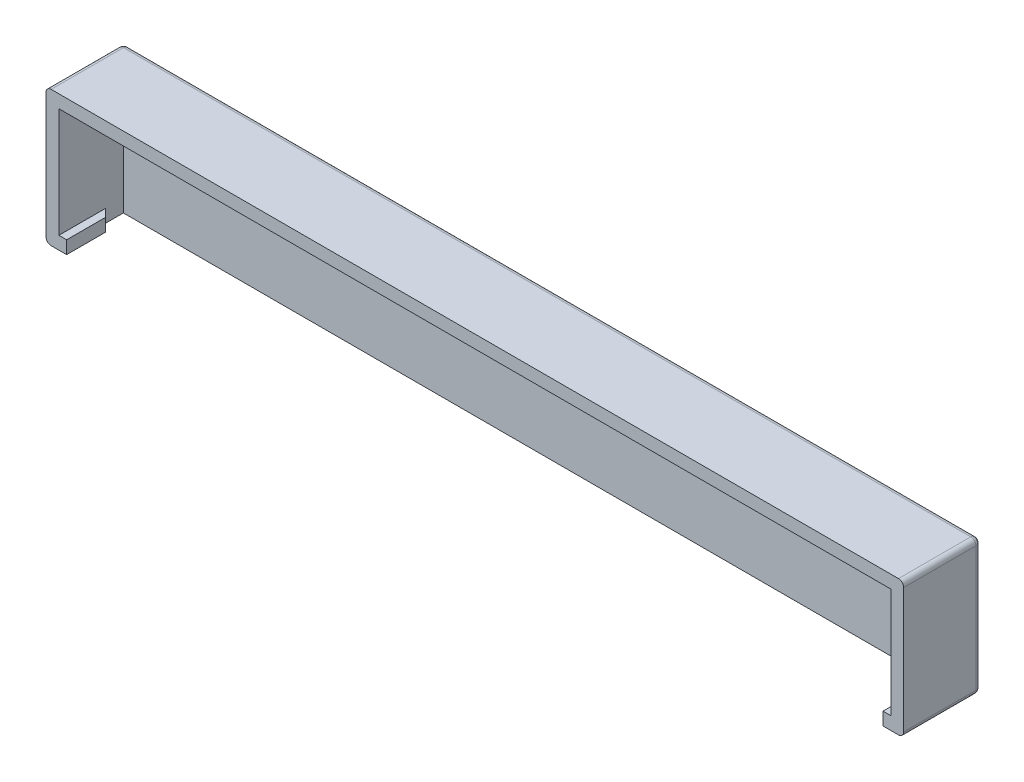
from build123d import *

# Parameters (mm, degrees)
SKETCH1_W           = 211.1375
SKETCH1_H           = 33.3375
BOSS_EXTRUDE1_DEPTH = 3.175
BOSS_EXTRUDE2_DEPTH = 15.875
CUT_EXTRUDE1_REACH  = 216.6
FILLET1_R           = 1.27


with BuildPart() as part:
    # Sketch1 → Boss-Extrude1 (new body)
    with BuildSketch(Plane.XY):
        with Locations((105.56875, 16.66875)):
            Rectangle(SKETCH1_W, SKETCH1_H)
    extrude(amount=BOSS_EXTRUDE1_DEPTH)

    # Sketch2 → Boss-Extrude2 (add)
    with BuildSketch(Plane.XY.offset(3.175)):
        Polygon((5.08, 0), (5.08, 3.175), (3.175, 3.175), (3.175, 30.1625), (207.9625, 30.1625), (207.9625, 3.175), (206.0575, 3.175), (206.0575, 0), (211.1375, 0), (211.1375, 33.3375), (0, 33.3375), (0, 0), align=None)
    extrude(amount=BOSS_EXTRUDE2_DEPTH)

    # Sketch3 → Cut-Extrude1 (cut, up to next)
    with BuildSketch(Plane.XZ, mode=Mode.PRIVATE) as cut_extrude1_sk1:
        Polygon((207.9625, 3.175), (206.0575, 3.175), (206.0575, 9.525), (207.9625, 7.62), align=None)
    cut_extrude1_tool1 = extrude(cut_extrude1_sk1.sketch, amount=-CUT_EXTRUDE1_REACH, mode=Mode.PRIVATE) & part.part
    # Sketch3 → Cut-Extrude1 (cut, up to next)
    with BuildSketch(Plane.XZ, mode=Mode.PRIVATE) as cut_extrude1_sk2:
        Polygon((5.08, 9.525), (3.175, 7.62), (3.175, 3.175), (5.08, 3.175), align=None)
    cut_extrude1_tool2 = extrude(cut_extrude1_sk2.sketch, amount=-CUT_EXTRUDE1_REACH, mode=Mode.PRIVATE) & part.part
    add(cut_extrude1_tool1.solids().sort_by_distance((206.953971, 0, 5.901765))[0], mode=Mode.SUBTRACT)
    add(cut_extrude1_tool2.solids().sort_by_distance((4.183529, 0, 5.901765))[0], mode=Mode.SUBTRACT)

    # Fillet1
    fillet1_edges = [part.edges().sort_by_distance(p)[0] for p in [
        (105.56875, 0, 0),
        (211.1375, 16.66875, 0),
        (105.56875, 33.3375, 0),
        (0, 16.66875, 0),
        (0, 0, 9.525),
        (211.1375, 0, 9.525),
        (211.1375, 33.3375, 9.525),
        (0, 33.3375, 9.525),
    ]]
    fillet(fillet1_edges, radius=FILLET1_R)


solid = part.part
